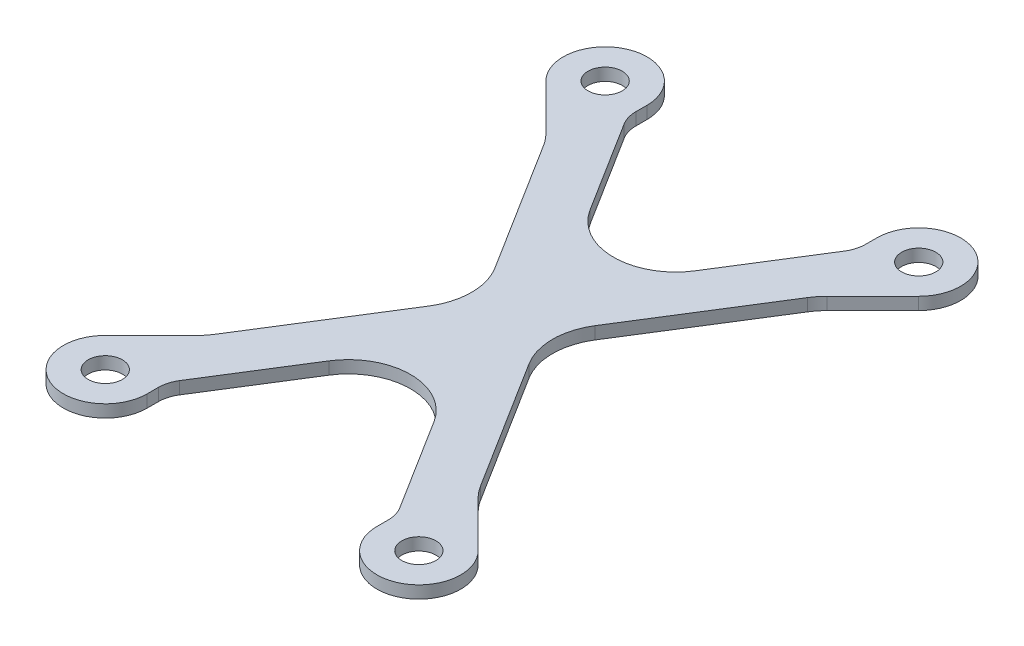
from build123d import *

# Parameters (mm, degrees)
SKETCH1_R           = 2.75
BOSS_EXTRUDE1_DEPTH = 2


with BuildPart() as part:
    # Sketch1 → Boss-Extrude1 (new body)
    with BuildSketch(Plane(origin=(0, 0, 0), x_dir=(1, 0, 0), z_dir=(0, 1, 0))):
        with BuildLine():
            ThreePointArc((-22.650842333, 28.104900787), (-21.901331942, 27.26589175), (-21.250806764, 26.34800342))
            Line((-21.250806764, 26.34800342), (-8.055669308, 5.314170444))
            ThreePointArc((-8.055669308, 5.314170444), (-6.526772689, 0), (-8.055669308, -5.314170444))
            Line((-8.055669308, -5.314170444), (-21.294498712, -26.41765098))
            ThreePointArc((-21.294498712, -26.41765098), (-21.94502389, -27.33553931), (-22.694534281, -28.174548348))
            Line((-22.694534281, -28.174548348), (-30.36172718, -35.841741247))
            ThreePointArc((-30.36172718, -35.841741247), (-27.601418884, -46.577189679), (-18.5, -40.25))
            Line((-18.5, -40.25), (-18.5, -38.455653201))
            ThreePointArc((-18.5, -38.455653201), (-18.305088888, -37.073220282), (-17.735551691, -35.798567979))
            Line((-17.735551691, -35.798567979), (-8.471103381, -21.03048701))
            ThreePointArc((-8.471103381, -21.03048701), (0, -16.344657454), (8.471103381, -21.03048701))
            Line((8.471103381, -21.03048701), (17.735551691, -35.798567979))
            ThreePointArc((17.735551691, -35.798567979), (18.305088888, -37.073220282), (18.5, -38.455653201))
            Line((18.5, -38.455653201), (18.5, -40.25))
            ThreePointArc((18.5, -40.25), (27.833113168, -46.486186844), (30.022970773, -35.477029227))
            Line((30.022970773, -35.477029227), (22.650842334, -28.104900787))
            ThreePointArc((22.650842334, -28.104900787), (21.901331942, -27.26589175), (21.250806764, -26.34800342))
            Line((21.250806764, -26.34800342), (8.055669308, -5.314170444))
            ThreePointArc((8.055669308, -5.314170444), (6.526772689, 0), (8.055669308, 5.314170444))
            Line((8.055669308, 5.314170444), (21.250806764, 26.34800342))
            ThreePointArc((21.250806764, 26.34800342), (21.901331942, 27.26589175), (22.650842333, 28.104900787))
            Line((22.650842333, 28.104900787), (30.022970773, 35.477029227))
            ThreePointArc((30.022970773, 35.477029227), (27.833113168, 46.486186844), (18.5, 40.25))
            Line((18.5, 40.25), (18.5, 38.455653201))
            ThreePointArc((18.5, 38.455653201), (18.305088888, 37.073220282), (17.735551691, 35.798567979))
            Line((17.735551691, 35.798567979), (8.471103381, 21.03048701))
            ThreePointArc((8.471103381, 21.03048701), (0, 16.344657454), (-8.471103381, 21.03048701))
            Line((-8.471103381, 21.03048701), (-17.735551691, 35.798567979))
            ThreePointArc((-17.735551691, 35.798567979), (-18.305088889, 37.073220282), (-18.5, 38.455653201))
            Line((-18.5, 38.455653201), (-18.5, 40.25))
            ThreePointArc((-18.5, 40.25), (-27.833113168, 46.486186844), (-30.022970773, 35.477029227))
            Line((-30.022970773, 35.477029227), (-22.650842333, 28.104900787))
        make_face()
        with Locations(Location((-25.25, -40.25, 0), (0, 0, 270))):
            Circle(SKETCH1_R, mode=Mode.SUBTRACT)
        with Locations(Location((-25.25, 40.25, 0), (0, 0, 270))):
            Circle(SKETCH1_R, mode=Mode.SUBTRACT)
        with Locations(Location((25.25, 40.25, 0), (0, 0, 270))):
            Circle(SKETCH1_R, mode=Mode.SUBTRACT)
        with Locations(Location((25.25, -40.25, 0), (0, 0, 270))):
            Circle(SKETCH1_R, mode=Mode.SUBTRACT)
    extrude(amount=BOSS_EXTRUDE1_DEPTH)


solid = part.part
